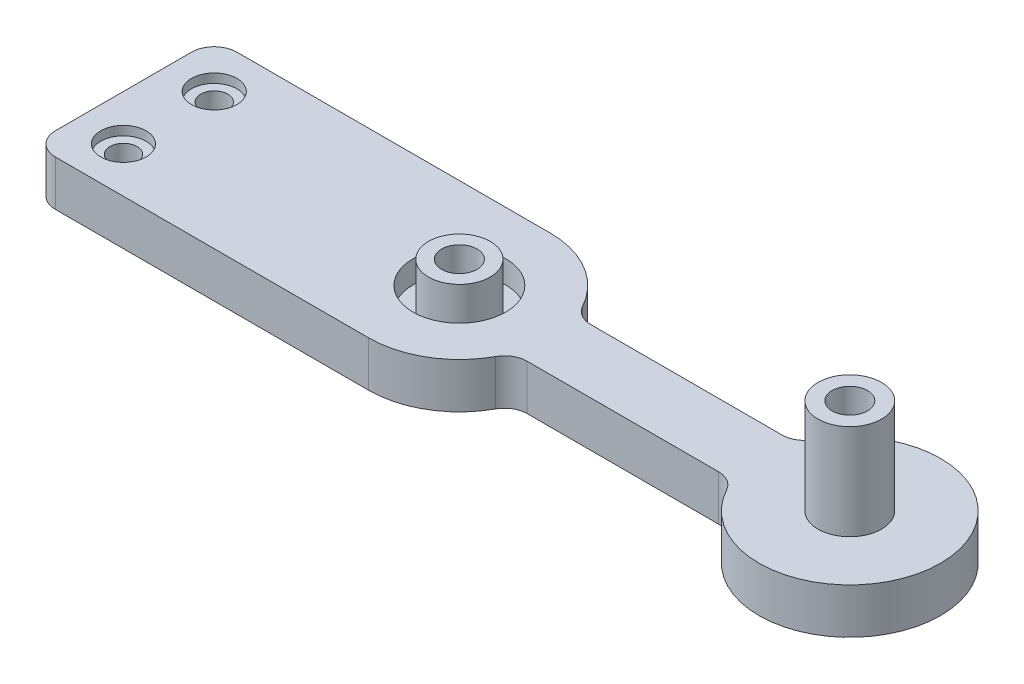
from build123d import *

# Parameters (mm, degrees)
SKETCH1_R              = 2.4765
BOSS_EXTRUDE1_DEPTH    = 6.35
SKETCH2_R              = 6.477
CUT_EXTRUDE1_DEPTH     = 3.175
SKETCH3_R              = 4.318
SKETCH3_R_2            = 2.4765
BOSS_EXTRUDE2_DEPTH    = 6.35
SKETCH4_R              = 4.445
SKETCH4_R_2            = 2.4765
BOSS_EXTRUDE3_DEPTH    = 13.335
SKETCH6_R              = 3.175
CUT_EXTRUDE2_DEPTH     = 1.27
F_10_24_TAPPED_HOLE1_D = 3.7973


with BuildPart() as part:
    # Sketch1 → Boss-Extrude1 (new body)
    with BuildSketch(Plane(origin=(0, 0, 0), x_dir=(1, 0, 0), z_dir=(0, 1, 0))):
        with BuildLine():
            Line((0, 12.7), (-43.815, 12.7))
            ThreePointArc((-43.815, 12.7), (-46.06006403, 11.77006403), (-46.99, 9.525))
            Line((-46.99, 9.525), (-46.99, -9.525))
            ThreePointArc((-46.99, -9.525), (-46.06006403, -11.77006403), (-43.815, -12.7))
            Line((-43.815, -12.7), (0, -12.7))
            ThreePointArc((0, -12.7), (6.475754782, -10.924953089), (11.141309797, -6.096))
            ThreePointArc((11.141309797, -6.096), (12.307698551, -4.888761728), (13.926637247, -4.445))
            Line((13.926637247, -4.445), (40.683362753, -4.445))
            ThreePointArc((40.683362753, -4.445), (42.302301449, -4.888761728), (43.468690203, -6.096))
            ThreePointArc((43.468690203, -6.096), (67.31, 0), (43.468690203, 6.096))
            ThreePointArc((43.468690203, 6.096), (42.302301449, 4.888761728), (40.683362753, 4.445))
            Line((40.683362753, 4.445), (13.926637247, 4.445))
            ThreePointArc((13.926637247, 4.445), (12.307698551, 4.888761728), (11.141309797, 6.096))
            ThreePointArc((11.141309797, 6.096), (6.475754782, 10.924953089), (0, 12.7))
        make_face()
        with Locations(Location((0, 0, 0), (0, 0, 270))):
            Circle(SKETCH1_R, mode=Mode.SUBTRACT)
        with Locations(Location((54.61, 0, 0), (0, 0, 270))):
            Circle(SKETCH1_R, mode=Mode.SUBTRACT)
    extrude(amount=BOSS_EXTRUDE1_DEPTH)

    # Sketch2 → Cut-Extrude1 (cut)
    with BuildSketch(Plane(origin=(0, 6.35, 0), x_dir=(1, 0, 0), z_dir=(0, 1, 0))):
        with Locations(Location((0, 0, 0), (0, 0, 270))):
            Circle(SKETCH2_R)
    extrude(amount=-CUT_EXTRUDE1_DEPTH, mode=Mode.SUBTRACT)

    # Sketch3 → Boss-Extrude2 (add)
    with BuildSketch(Plane(origin=(0, 3.175, 0), x_dir=(1, 0, 0), z_dir=(0, 1, 0))):
        with Locations(Location((0, 0, 0), (0, 0, 270))):
            Circle(SKETCH3_R)
        with Locations(Location((0, 0, 0), (0, 0, 270))):
            Circle(SKETCH3_R_2, mode=Mode.SUBTRACT)
    extrude(amount=BOSS_EXTRUDE2_DEPTH)

    # Sketch4 → Boss-Extrude3 (add)
    with BuildSketch(Plane(origin=(0, 6.35, 0), x_dir=(1, 0, 0), z_dir=(0, 1, 0))):
        with Locations(Location((54.61, 0, 0), (0, 0, 270))):
            Circle(SKETCH4_R)
        with Locations(Location((54.61, 0, 0), (0, 0, 270))):
            Circle(SKETCH4_R_2, mode=Mode.SUBTRACT)
    extrude(amount=BOSS_EXTRUDE3_DEPTH)

    # Sketch6 → Cut-Extrude2 (cut)
    with BuildSketch(Plane(origin=(0, 6.35, 0), x_dir=(1, 0, 0), z_dir=(0, 1, 0))):
        with Locations(Location((-40.64, 6.35, 0), (0, 0, 270))):
            Circle(SKETCH6_R)
        with Locations(Location((-40.64, -6.35, 0), (0, 0, 270))):
            Circle(SKETCH6_R)
    extrude(amount=-CUT_EXTRUDE2_DEPTH, mode=Mode.SUBTRACT)

    # #10-24 Tapped Hole1 (through all)
    with Locations(Plane(origin=(-40.64, 6.35, -6.35), x_dir=(0, 0, 1), z_dir=(0, 1, 0))):
        with Locations((0, 0), (12.7, 0)):
            Hole(F_10_24_TAPPED_HOLE1_D / 2)


solid = part.part
